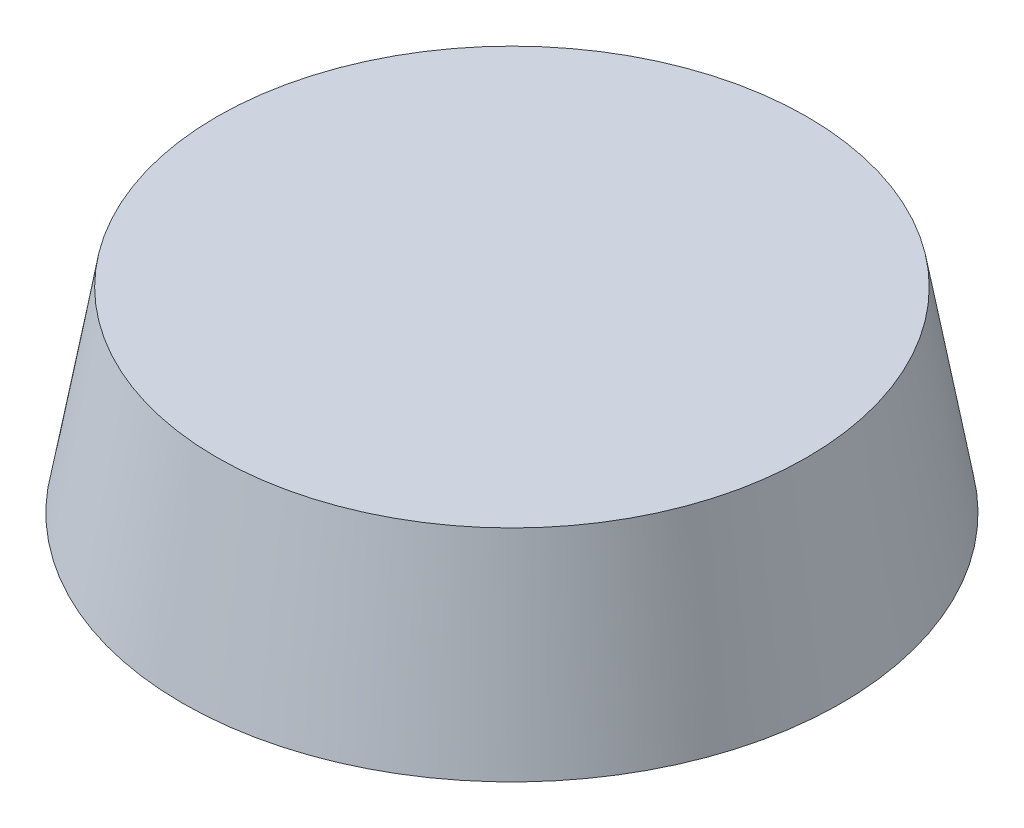
from build123d import *


with BuildPart() as part:
    # Sketch1 → Revolve-Thin1 (revolve)
    with BuildSketch(Plane.XY, mode=Mode.PRIVATE) as revolve_thin1_sk:
        Polygon((0, 7), (-10.765711135, 7), (-12, 0), (-12.492403877, 0.086824089), (-11.185260951, 7.5), (0, 7.5), align=None)
    revolve(revolve_thin1_sk.sketch.rotate(Axis((0, 62.169205868, 0), (0, -1, 0)), 270), axis=Axis((0, 62.169205868, 0), (0, -1, 0)))

    # Split1
    split(bisect_by=Plane(origin=(0, 0.086824089, 0), x_dir=(0, 0, -1), z_dir=(0, -1, 0)), keep=Keep.BOTTOM)


solid = part.part
